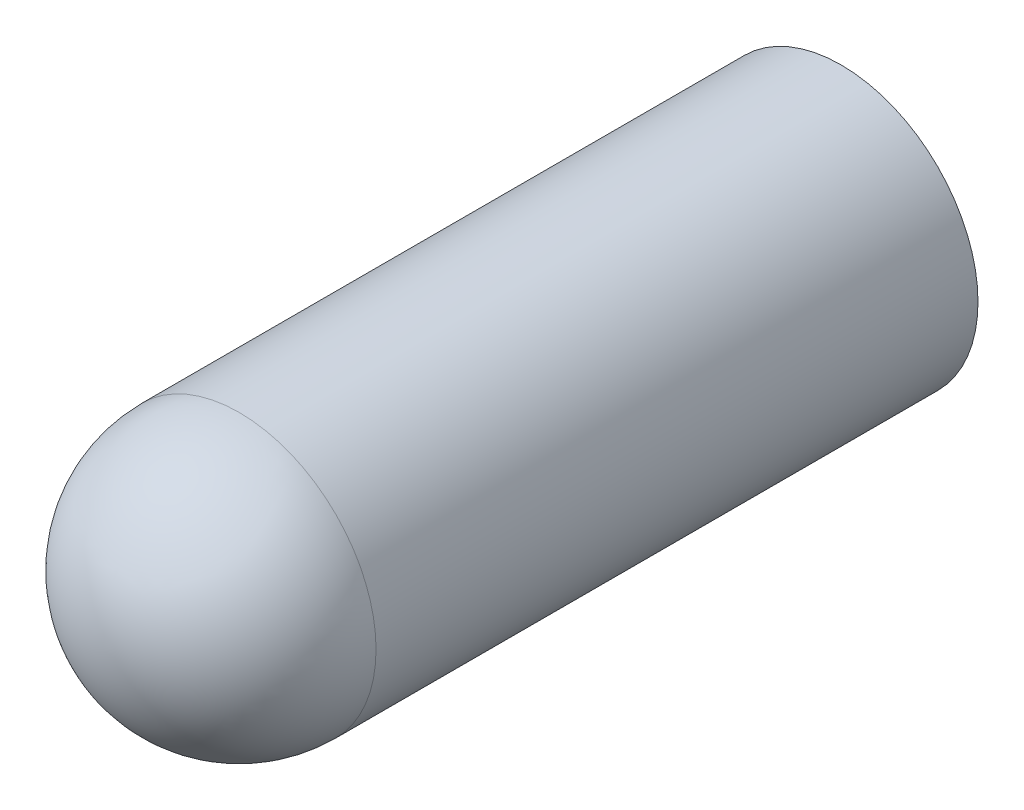
from build123d import *

# Parameters (mm, degrees)
ESQUISSE1_R      = 2.5
EXTRUSION1_DEPTH = 5.5


with BuildPart() as part:
    # Esquisse1 → Extrusion1 (new, symmetric)
    with BuildSketch(Plane.XY):
        Circle(ESQUISSE1_R)
    extrude(amount=EXTRUSION1_DEPTH, both=True)

    # Esquisse2 → Révolution1 (revolve)
    with BuildSketch(Plane(origin=(0, 0, 0), x_dir=(0, 0, -1), z_dir=(1, 0, 0))):
        with BuildLine():
            Line((-5.5, 2.5), (-5.5, 0))
            Line((-5.5, 0), (-8, 0))
            ThreePointArc((-8, 0), (-7.267766953, 1.767766953), (-5.5, 2.5))
        make_face()
    revolve(axis=Axis((0, 0, 5.5), (0, 0, 1)))


solid = part.part
